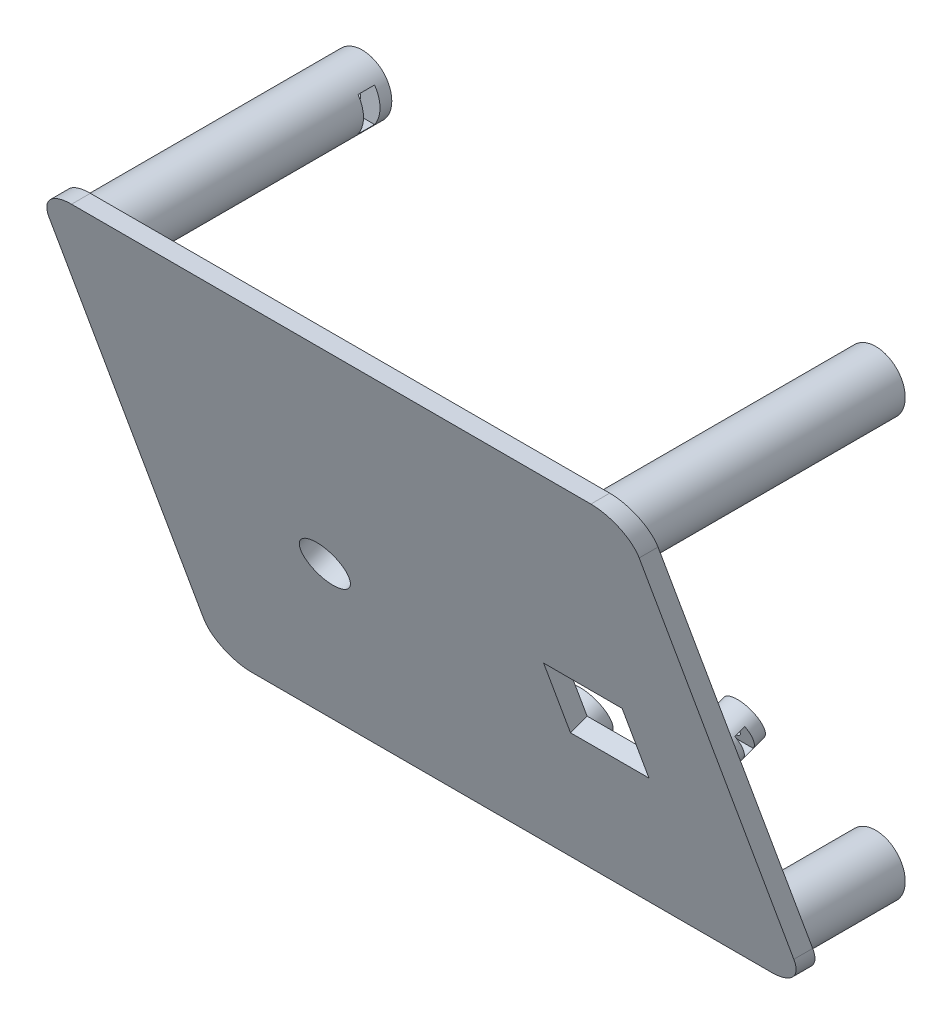
from build123d import *

# Parameters (mm, degrees)
LID_BLANK_DEPTH                 = 56
OUTER_PANEL_20DEG_DEPTH         = 143.098557347
OUTER_PANEL_20DEG_DEPTH_BACK    = 143.098557347
PANEL_3MM_DEPTH                 = 141.483885809
PANEL_3MM_DEPTH_BACK            = 141.483885809
HIDDEN_CASE_POST_0_START        = 3
SKETCH_4_R                      = 5
HIDDEN_CASE_POST_0_DEPTH        = 22.878191011
HIDDEN_CASE_POST_1_START        = 3
SKETCH_5_R                      = 5
HIDDEN_CASE_POST_1_DEPTH        = 22.878191011
HIDDEN_CASE_POST_2_START        = 3
SKETCH_6_R                      = 5
HIDDEN_CASE_POST_2_DEPTH        = 48.720077644
HIDDEN_CASE_POST_3_START        = 3
SKETCH_7_R                      = 5
HIDDEN_CASE_POST_3_DEPTH        = 48.720077644
FLUSH_OUTER_SURFACE_DEPTH       = 141.483885809
FLUSH_OUTER_SURFACE_DEPTH_BACK  = 141.483885809
BLIND_M3_0_START                = 3
SKETCH_9_R                      = 1.7
BLIND_M3_0_DEPTH                = 9.5
M3_SIDE_LOAD_NUT_0_START        = 3.1
SKETCH_10_W                     = 2.8
SKETCH_10_H                     = 5.8
M3_SIDE_LOAD_NUT_0_DEPTH        = 9.4
BLIND_M3_1_START                = 3
SKETCH_11_R                     = 1.7
BLIND_M3_1_DEPTH                = 9.5
M3_SIDE_LOAD_NUT_1_START        = 87.5
SKETCH_12_W                     = 2.8
SKETCH_12_H                     = 5.8
M3_SIDE_LOAD_NUT_1_DEPTH        = 9.4
BLIND_M3_2_START                = 3
SKETCH_13_R                     = 1.7
BLIND_M3_2_DEPTH                = 9.5
M3_SIDE_LOAD_NUT_2_START        = 3.1
SKETCH_14_W                     = 2.8
SKETCH_14_H                     = 5.8
M3_SIDE_LOAD_NUT_2_DEPTH        = 9.4
BLIND_M3_3_START                = 3
SKETCH_15_R                     = 1.7
BLIND_M3_3_DEPTH                = 9.5
M3_SIDE_LOAD_NUT_3_START        = 87.5
SKETCH_16_W                     = 2.8
SKETCH_16_H                     = 5.8
M3_SIDE_LOAD_NUT_3_DEPTH        = 9.4
SKETCH_17_R                     = 4.1
SHAFT_D8P2_DEPTH                = 5
SKETCH_18_W                     = 13.3
SKETCH_18_H                     = 13.3
BUTTON_13P3_CLEARANCE_DEPTH     = 5
SKETCH_19_R                     = 4
ENCODER_FRONT_BLIND_POST_DEPTH  = 11.07
ENCODER_FRONT_BLIND_SCREW_START = -14.07
SKETCH_20_R                     = 1.15
ENCODER_FRONT_BLIND_SCREW_DEPTH = 5
ENCODER_FRONT_M2_SIDE_NUT_START = 20.5
ENCODER_FRONT_M2_SIDE_NUT_DEPTH = 7.5
SKETCH_22_R                     = 4
ENCODER_REAR_BLIND_POST_DEPTH   = 11.07
ENCODER_REAR_BLIND_SCREW_START  = -14.07
SKETCH_23_R                     = 1.15
ENCODER_REAR_BLIND_SCREW_DEPTH  = 5
ENCODER_REAR_M2_SIDE_NUT_START  = 44.5
ENCODER_REAR_M2_SIDE_NUT_DEPTH  = 7.5
SKETCH_25_R                     = 4
BUTTON_LEFT_BLIND_POST_DEPTH    = 6.7
BUTTON_LEFT_BLIND_SCREW_START   = -9.7
SKETCH_26_R                     = 1.15
BUTTON_LEFT_BLIND_SCREW_DEPTH   = 5
BUTTON_LEFT_M2_SIDE_NUT_START   = 57.5
BUTTON_LEFT_M2_SIDE_NUT_DEPTH   = 7.5
SKETCH_28_R                     = 3.4
BUTTON_RIGHT_BLIND_POST_DEPTH   = 6.7
BUTTON_RIGHT_BLIND_SCREW_START  = -9.7
SKETCH_29_R                     = 1.15
BUTTON_RIGHT_BLIND_SCREW_DEPTH  = 5
BUTTON_RIGHT_M2_SIDE_NUT_START  = 90.8
BUTTON_RIGHT_M2_SIDE_NUT_DEPTH  = 7.5


with BuildPart() as part:
    # 草图1 → Lid_blank (new body)
    with BuildSketch(Plane.XY):
        with BuildLine():
            Line((6, 0), (94, 0))
            ThreePointArc((94, 0), (98.242640687, 1.757359313), (100, 6))
            Line((100, 6), (100, 78))
            ThreePointArc((100, 78), (98.242640687, 82.242640687), (94, 84))
            Line((94, 84), (6, 84))
            ThreePointArc((6, 84), (1.757359313, 82.242640687), (0, 78))
            Line((0, 78), (0, 6))
            ThreePointArc((0, 6), (1.757359313, 1.757359313), (6, 0))
        make_face()
    extrude(amount=LID_BLANK_DEPTH)

    # 草图2 → Outer_panel_20deg (cut, two sides: drawn at the far end of the back side and taken through both)
    with BuildSketch(Plane(origin=(0, 0, 0), x_dir=(0, 0, -1), z_dir=(1, 0, 0)).offset(-OUTER_PANEL_20DEG_DEPTH_BACK)):
        Polygon((-13.913128632, -20), (-61.229259087, 110), (-120, 110), (-120, -20), align=None)
    extrude(amount=OUTER_PANEL_20DEG_DEPTH + OUTER_PANEL_20DEG_DEPTH_BACK, mode=Mode.SUBTRACT)

    # 草图3 → Panel_3mm (cut, two sides: drawn at the far end of the back side and taken through both)
    with BuildSketch(Plane(origin=(0, 0, 0), x_dir=(0, 0, -1), z_dir=(1, 0, 0)).offset(-PANEL_3MM_DEPTH_BACK)):
        Polygon((-10.720595315, -20), (-58.036725769, 110), (30, 110), (30, -20), align=None)
    extrude(amount=PANEL_3MM_DEPTH + PANEL_3MM_DEPTH_BACK, mode=Mode.SUBTRACT)

    # 草图4 → Hidden_case_post_0 (add)
    with BuildSketch(Plane.XY.offset(HIDDEN_CASE_POST_0_START)):
        with Locations(Location((6.5, 6.5, 0), (0, 0, 270))):
            Circle(SKETCH_4_R)
    extrude(amount=HIDDEN_CASE_POST_0_DEPTH)

    # 草图5 → Hidden_case_post_1 (add)
    with BuildSketch(Plane.XY.offset(HIDDEN_CASE_POST_1_START)):
        with Locations(Location((93.5, 6.5, 0), (0, 0, 270))):
            Circle(SKETCH_5_R)
    extrude(amount=HIDDEN_CASE_POST_1_DEPTH)

    # 草图6 → Hidden_case_post_2 (add)
    with BuildSketch(Plane.XY.offset(HIDDEN_CASE_POST_2_START)):
        with Locations(Location((6.5, 77.5, 0), (0, 0, 270))):
            Circle(SKETCH_6_R)
    extrude(amount=HIDDEN_CASE_POST_2_DEPTH)

    # 草图7 → Hidden_case_post_3 (add)
    with BuildSketch(Plane.XY.offset(HIDDEN_CASE_POST_3_START)):
        with Locations(Location((93.5, 77.5, 0), (0, 0, 270))):
            Circle(SKETCH_7_R)
    extrude(amount=HIDDEN_CASE_POST_3_DEPTH)

    # 草图8 → Flush_outer_surface (cut, two sides: drawn at the far end of the back side and taken through both)
    with BuildSketch(Plane(origin=(0, 0, 0), x_dir=(0, 0, -1), z_dir=(1, 0, 0)).offset(-FLUSH_OUTER_SURFACE_DEPTH_BACK)):
        Polygon((-13.913128632, -20), (-61.229259087, 110), (-120, 110), (-120, -20), align=None)
    extrude(amount=FLUSH_OUTER_SURFACE_DEPTH + FLUSH_OUTER_SURFACE_DEPTH_BACK, mode=Mode.SUBTRACT)

    # 草图9 → Blind_M3_0 (cut)
    with BuildSketch(Plane.XY.offset(BLIND_M3_0_START)):
        with Locations((6.5, 6.5)):
            Circle(SKETCH_9_R)
    extrude(amount=BLIND_M3_0_DEPTH, mode=Mode.SUBTRACT)

    # 草图10 → M3_side_load_nut_0 (cut)
    with BuildSketch(Plane(origin=(0, 0, 0), x_dir=(0, 0, -1), z_dir=(1, 0, 0)).offset(M3_SIDE_LOAD_NUT_0_START)):
        with Locations((-6.4, 6.5)):
            Rectangle(SKETCH_10_W, SKETCH_10_H)
    extrude(amount=M3_SIDE_LOAD_NUT_0_DEPTH, mode=Mode.SUBTRACT)

    # 草图11 → Blind_M3_1 (cut)
    with BuildSketch(Plane.XY.offset(BLIND_M3_1_START)):
        with Locations((93.5, 6.5)):
            Circle(SKETCH_11_R)
    extrude(amount=BLIND_M3_1_DEPTH, mode=Mode.SUBTRACT)

    # 草图12 → M3_side_load_nut_1 (cut)
    with BuildSketch(Plane(origin=(0, 0, 0), x_dir=(0, 0, -1), z_dir=(1, 0, 0)).offset(M3_SIDE_LOAD_NUT_1_START)):
        with Locations((-6.4, 6.5)):
            Rectangle(SKETCH_12_W, SKETCH_12_H)
    extrude(amount=M3_SIDE_LOAD_NUT_1_DEPTH, mode=Mode.SUBTRACT)

    # 草图13 → Blind_M3_2 (cut)
    with BuildSketch(Plane.XY.offset(BLIND_M3_2_START)):
        with Locations((6.5, 77.5)):
            Circle(SKETCH_13_R)
    extrude(amount=BLIND_M3_2_DEPTH, mode=Mode.SUBTRACT)

    # 草图14 → M3_side_load_nut_2 (cut)
    with BuildSketch(Plane(origin=(0, 0, 0), x_dir=(0, 0, -1), z_dir=(1, 0, 0)).offset(M3_SIDE_LOAD_NUT_2_START)):
        with Locations((-6.4, 77.5)):
            Rectangle(SKETCH_14_W, SKETCH_14_H)
    extrude(amount=M3_SIDE_LOAD_NUT_2_DEPTH, mode=Mode.SUBTRACT)

    # 草图15 → Blind_M3_3 (cut)
    with BuildSketch(Plane.XY.offset(BLIND_M3_3_START)):
        with Locations((93.5, 77.5)):
            Circle(SKETCH_15_R)
    extrude(amount=BLIND_M3_3_DEPTH, mode=Mode.SUBTRACT)

    # 草图16 → M3_side_load_nut_3 (cut)
    with BuildSketch(Plane(origin=(0, 0, 0), x_dir=(0, 0, -1), z_dir=(1, 0, 0)).offset(M3_SIDE_LOAD_NUT_3_START)):
        with Locations((-6.4, 77.5)):
            Rectangle(SKETCH_16_W, SKETCH_16_H)
    extrude(amount=M3_SIDE_LOAD_NUT_3_DEPTH, mode=Mode.SUBTRACT)

    # 草图17 → Shaft_D8p2 (cut)
    with BuildSketch(Plane(origin=(0, -6.811148917, 18.71347785), x_dir=(1, 0, 0), z_dir=(0, -0.3420201433256689, 0.9396926207859084))):
        with Locations(Location((31, 44.248273283, 0), (0, 0, 270))):
            Circle(SKETCH_17_R)
    extrude(amount=-SHAFT_D8P2_DEPTH, mode=Mode.SUBTRACT)

    # 草图18 → Button_13p3_clearance (cut)
    with BuildSketch(Plane(origin=(0, -6.811148917, 18.71347785), x_dir=(1, 0, 0), z_dir=(0, -0.3420201433256689, 0.9396926207859084))):
        with Locations((77, 44.248273283)):
            Rectangle(SKETCH_18_W, SKETCH_18_H)
    extrude(amount=-BUTTON_13P3_CLEARANCE_DEPTH, mode=Mode.SUBTRACT)

    # 草图19 → Encoder_front_blind_post (add)
    with BuildSketch(Plane(origin=(0, -5.785088487, 15.894399988), x_dir=(-1, 0, 0), z_dir=(0, 0.34202014332566866, -0.9396926207859085))):
        with Locations(Location((-23, 30.748273283, 0), (0, 0, 270))):
            Circle(SKETCH_19_R)
    extrude(amount=ENCODER_FRONT_BLIND_POST_DEPTH)

    # 草图20 → Encoder_front_blind_screw (cut)
    with BuildSketch(Plane(origin=(0, -6.811148917, 18.71347785), x_dir=(1, 0, 0), z_dir=(0, -0.3420201433256689, 0.9396926207859084)).offset(ENCODER_FRONT_BLIND_SCREW_START)):
        with Locations(Location((23, 30.748273283, 0), (0, 0, 270))):
            Circle(SKETCH_20_R)
    extrude(amount=ENCODER_FRONT_BLIND_SCREW_DEPTH, mode=Mode.SUBTRACT)

    # 草图21 → Encoder_front_M2_side_nut (cut)
    with BuildSketch(Plane(origin=(0, 0, 0), x_dir=(0, 0, -1), z_dir=(1, 0, 0)).offset(ENCODER_FRONT_M2_SIDE_NUT_START)):
        Polygon((-17.169674452, 24.237605215), (-18.606159054, 28.184314222), (-20.297605771, 27.568677964), (-18.861121169, 23.621968957), align=None)
    extrude(amount=ENCODER_FRONT_M2_SIDE_NUT_DEPTH, mode=Mode.SUBTRACT)

    # 草图22 → Encoder_rear_blind_post (add)
    with BuildSketch(Plane(origin=(0, -5.785088487, 15.894399988), x_dir=(-1, 0, 0), z_dir=(0, 0.34202014332566866, -0.9396926207859085))):
        with Locations(Location((-47, 57.748273283, 0), (0, 0, 270))):
            Circle(SKETCH_22_R)
    extrude(amount=ENCODER_REAR_BLIND_POST_DEPTH)

    # 草图23 → Encoder_rear_blind_screw (cut)
    with BuildSketch(Plane(origin=(0, -6.811148917, 18.71347785), x_dir=(1, 0, 0), z_dir=(0, -0.3420201433256689, 0.9396926207859084)).offset(ENCODER_REAR_BLIND_SCREW_START)):
        with Locations(Location((47, 57.748273283, 0), (0, 0, 270))):
            Circle(SKETCH_23_R)
    extrude(amount=ENCODER_REAR_BLIND_SCREW_DEPTH, mode=Mode.SUBTRACT)

    # 草图24 → Encoder_rear_M2_side_nut (cut)
    with BuildSketch(Plane(origin=(0, 0, 0), x_dir=(0, 0, -1), z_dir=(1, 0, 0)).offset(ENCODER_REAR_M2_SIDE_NUT_START)):
        Polygon((-26.404218322, 49.609305976), (-27.840702923, 53.556014983), (-29.532149641, 52.940378725), (-28.095665039, 48.993669718), align=None)
    extrude(amount=ENCODER_REAR_M2_SIDE_NUT_DEPTH, mode=Mode.SUBTRACT)

    # 草图25 → Button_left_blind_post (add)
    with BuildSketch(Plane(origin=(0, -5.785088487, 15.894399988), x_dir=(-1, 0, 0), z_dir=(0, 0.34202014332566866, -0.9396926207859085))):
        with Locations(Location((-60, 25.248273283, 0), (0, 0, 270))):
            Circle(SKETCH_25_R)
    extrude(amount=BUTTON_LEFT_BLIND_POST_DEPTH)

    # 草图26 → Button_left_blind_screw (cut)
    with BuildSketch(Plane(origin=(0, -6.811148917, 18.71347785), x_dir=(1, 0, 0), z_dir=(0, -0.3420201433256689, 0.9396926207859084)).offset(BUTTON_LEFT_BLIND_SCREW_START)):
        with Locations(Location((60, 25.248273283, 0), (0, 0, 270))):
            Circle(SKETCH_26_R)
    extrude(amount=BUTTON_LEFT_BLIND_SCREW_DEPTH, mode=Mode.SUBTRACT)

    # 草图27 → Button_left_M2_side_nut (cut)
    with BuildSketch(Plane(origin=(0, 0, 0), x_dir=(0, 0, -1), z_dir=(1, 0, 0)).offset(BUTTON_LEFT_M2_SIDE_NUT_START)):
        Polygon((-19.395020416, 17.574667774), (-20.831505018, 21.521376781), (-22.522951736, 20.905740523), (-21.086467134, 16.959031516), align=None)
    extrude(amount=BUTTON_LEFT_M2_SIDE_NUT_DEPTH, mode=Mode.SUBTRACT)

    # 草图28 → Button_right_blind_post (add)
    with BuildSketch(Plane(origin=(0, -5.785088487, 15.894399988), x_dir=(-1, 0, 0), z_dir=(0, 0.34202014332566866, -0.9396926207859085))):
        with Locations(Location((-93.3, 45.248273283, 0), (0, 0, 270))):
            Circle(SKETCH_28_R)
    extrude(amount=BUTTON_RIGHT_BLIND_POST_DEPTH)

    # 草图29 → Button_right_blind_screw (cut)
    with BuildSketch(Plane(origin=(0, -6.811148917, 18.71347785), x_dir=(1, 0, 0), z_dir=(0, -0.3420201433256689, 0.9396926207859084)).offset(BUTTON_RIGHT_BLIND_SCREW_START)):
        with Locations(Location((93.3, 45.248273283, 0), (0, 0, 270))):
            Circle(SKETCH_29_R)
    extrude(amount=BUTTON_RIGHT_BLIND_SCREW_DEPTH, mode=Mode.SUBTRACT)

    # 草图30 → Button_right_M2_side_nut (cut)
    with BuildSketch(Plane(origin=(0, 0, 0), x_dir=(0, 0, -1), z_dir=(1, 0, 0)).offset(BUTTON_RIGHT_M2_SIDE_NUT_START)):
        Polygon((-26.235423283, 36.36852019), (-27.671907885, 40.315229197), (-29.363354602, 39.699592939), (-27.92687, 35.752883932), align=None)
    extrude(amount=BUTTON_RIGHT_M2_SIDE_NUT_DEPTH, mode=Mode.SUBTRACT)


solid = part.part
